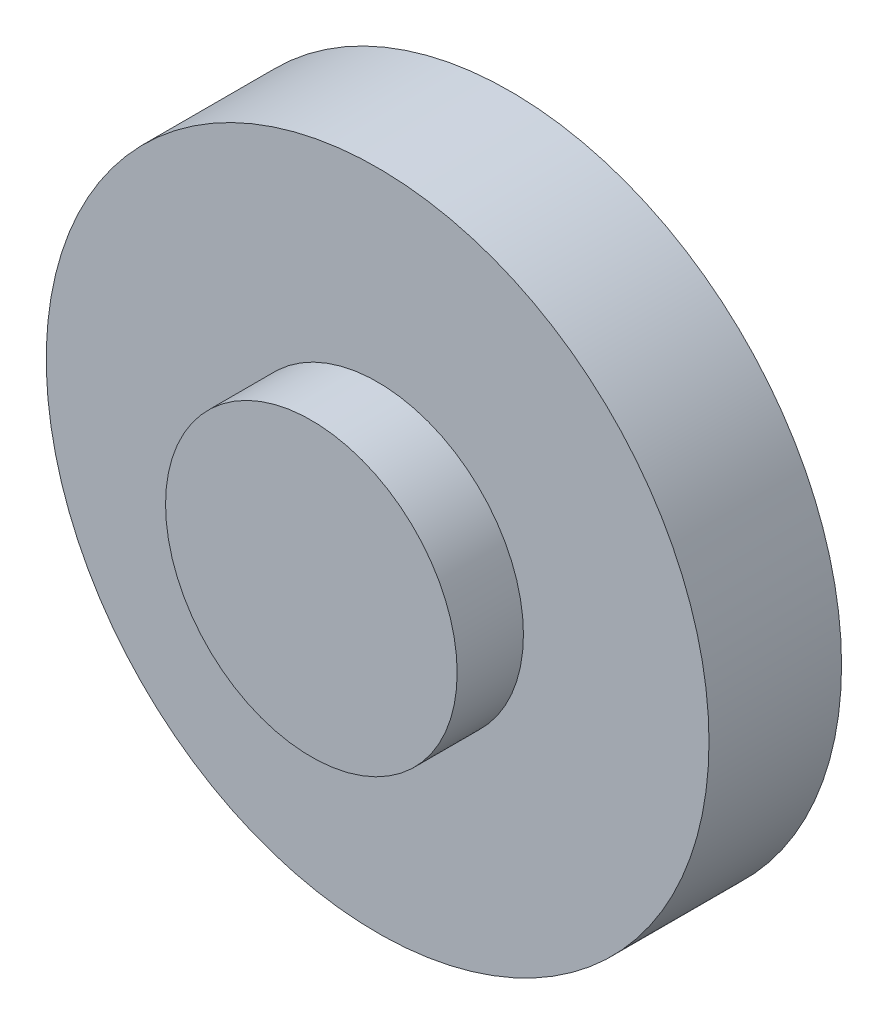
from build123d import *

# Parameters (mm, degrees)
SKETCH1_R           = 25
BOSS_EXTRUDE1_DEPTH = 10
SKETCH3_R           = 11
BOSS_EXTRUDE2_DEPTH = 5


with BuildPart() as part:
    # Sketch1 → Boss-Extrude1 (new body)
    with BuildSketch(Plane.XY):
        Circle(SKETCH1_R)
    extrude(amount=BOSS_EXTRUDE1_DEPTH)

    # Sketch3 → Boss-Extrude2 (add)
    with BuildSketch(Plane.XY.offset(10)):
        Circle(SKETCH3_R)
    extrude(amount=BOSS_EXTRUDE2_DEPTH)


solid = part.part
